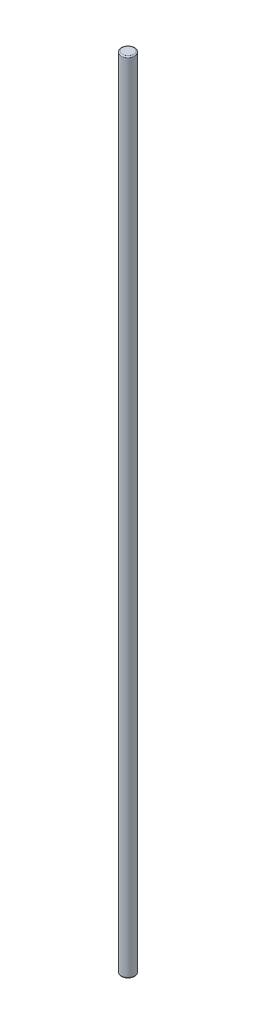
from build123d import *

# Parameters (mm, degrees)
SKETCH_1_R      = 3
EXTRUDE_1_DEPTH = 350
FILLET_1_R      = 0.5
FILLET_2_R      = 0.5


with BuildPart() as part:
    # 草图1 → 凸台-拉伸1 (new body)
    with BuildSketch(Plane(origin=(0, 0, 0), x_dir=(1, 0, 0), z_dir=(0, 1, 0))):
        with Locations(Location((0, 0, 0), (0, 0, 270))):
            Circle(SKETCH_1_R)
    extrude(amount=EXTRUDE_1_DEPTH)

    # 圆角1
    fillet_1_edges = [part.edges().sort_by_distance(p)[0] for p in [
        (0, 0, -3),
    ]]
    fillet(fillet_1_edges, radius=FILLET_1_R)

    # 圆角2
    fillet_2_edges = [part.edges().sort_by_distance(p)[0] for p in [
        (0, 350, -3),
    ]]
    fillet(fillet_2_edges, radius=FILLET_2_R)


solid = part.part
